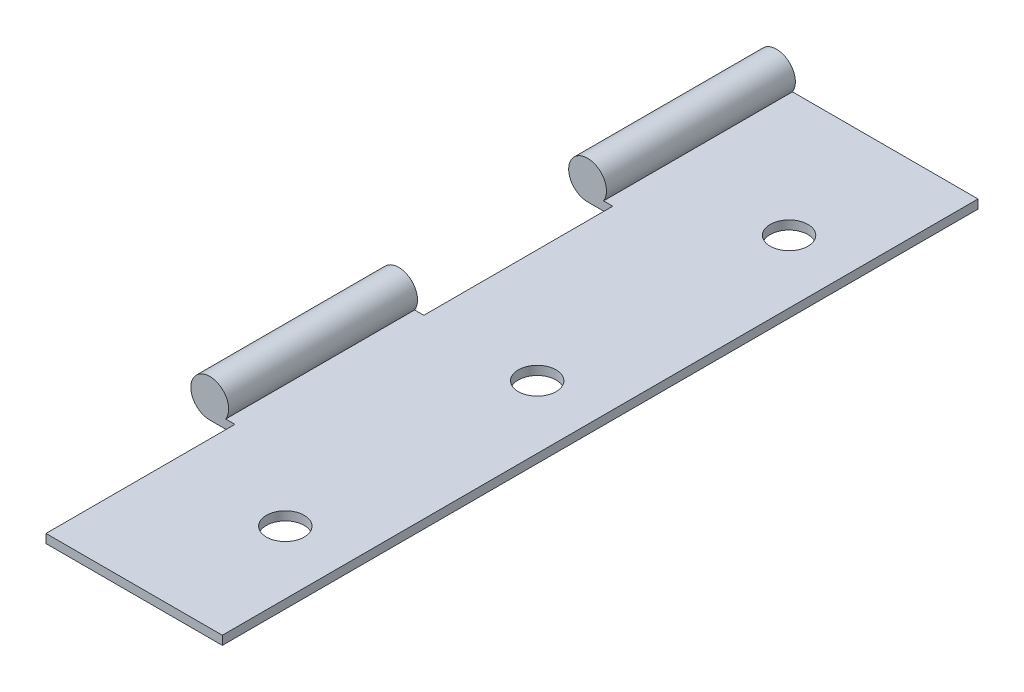
from build123d import *

# Parameters (mm, degrees)
EXTRUSION1_DEPTH           = 60
EXTRUSION2_START           = -10
ESQUISSE2_W                = 7.046962448
ESQUISSE2_H                = 15
EXTRUSION2_DEPTH           = 73.139279043
R_P_TITION_LIN_AIRE1_COUNT = 2
R_P_TITION_LIN_AIRE1_PITCH = 30
ESQUISSE3_R                = 1.5
EXTRUSION3_DEPTH           = 63.139279043
R_P_TITION_LIN_AIRE2_COUNT = 3
R_P_TITION_LIN_AIRE2_PITCH = 20


with BuildPart() as part:
    # Esquisse1 → Extrusion1 (new body)
    with BuildSketch(Plane.XY):
        with BuildLine():
            Line((0, 0), (16, 0))
            Line((16, 0), (16, 0.7))
            Line((16, 0.7), (1.268857754, 0.7))
            ThreePointArc((1.268857754, 0.7), (-0.724568837, 2.813392554), (0, 0))
        make_face()
    extrude(amount=EXTRUSION1_DEPTH)

    # Esquisse2 → Extrusion2 (cut, through all)
    with BuildSketch(Plane(origin=(0, 0.7, 0), x_dir=(1, 0, 0), z_dir=(0, 1, 0)).offset(EXTRUSION2_START)):
        with Locations((-1.523481224, -52.5)):
            Rectangle(ESQUISSE2_W, ESQUISSE2_H)
    extrusion2 = extrude(amount=EXTRUSION2_DEPTH, mode=Mode.SUBTRACT)

    # Répétition linéaire1: Extrusion2 ×2
    with Locations(*[(0, 0, -i * R_P_TITION_LIN_AIRE1_PITCH) for i in range(1, R_P_TITION_LIN_AIRE1_COUNT)]):
        add(extrusion2, mode=Mode.SUBTRACT)

    # Esquisse3 → Extrusion3 (cut, through all)
    with BuildSketch(Plane(origin=(0, 0.7, 0), x_dir=(1, 0, 0), z_dir=(0, 1, 0))):
        with Locations(Location((11, -50, 0), (0, 0, 180))):
            Circle(ESQUISSE3_R)
    extrusion3 = extrude(amount=-EXTRUSION3_DEPTH, mode=Mode.SUBTRACT)

    # Répétition linéaire2: Extrusion3 ×3
    with Locations(*[(0, 0, -i * R_P_TITION_LIN_AIRE2_PITCH) for i in range(1, R_P_TITION_LIN_AIRE2_COUNT)]):
        add(extrusion3, mode=Mode.SUBTRACT)


solid = part.part
